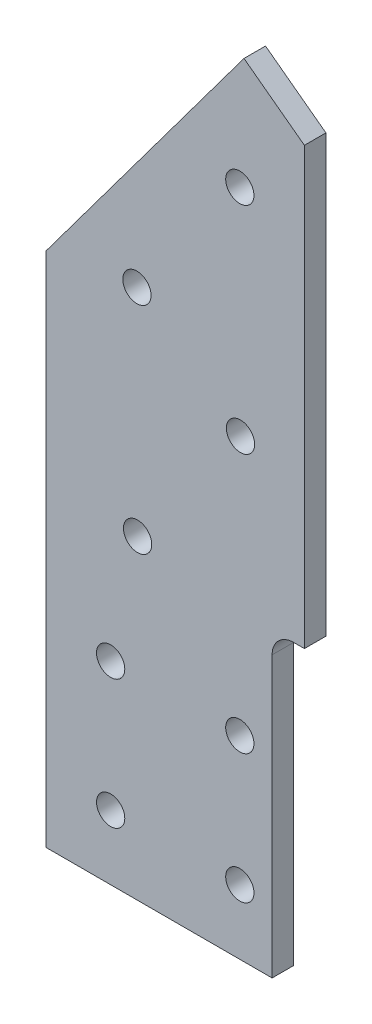
from build123d import *

# Parameters (mm, degrees)
BOSS_EXTRUDE1_DEPTH              = 6.35
F_21_64_0_32813_DIAMETER_HOLE1_D = 8.334502
LPATTERN1_COUNT                  = 2
LPATTERN1_PITCH                  = 38.1
LPATTERN1_COUNT_DIR2             = 2
LPATTERN1_PITCH_DIR2             = 38.1
F_21_64_0_32813_DIAMETER_HOLE2_D = 8.334502
LPATTERN2_COUNT                  = 3
LPATTERN2_PITCH                  = 50.8
LPATTERN2_COUNT_DIR2             = 2
LPATTERN2_PITCH_DIR2             = 38.1
SKETCH7_W                        = 9.525
SKETCH7_H                        = 88.9
CUT_EXTRUDE1_DEPTH               = 244.088107491
FILLET1_R                        = 6.35


with BuildPart() as part:
    # Sketch2 → Boss-Extrude1 (new body)
    with BuildSketch(Plane.XY):
        Polygon((0, 0), (76.2, 0), (76.2, 217.469814476), (58.378218394, 230.748923082), (0, 152.4), align=None)
    extrude(amount=BOSS_EXTRUDE1_DEPTH)

    # 21/64 (0.32813) Diameter Hole1 (through all)
    with Locations(Plane.XY.offset(6.35)):
        with Locations((57.15, 19.05)):
            f_21_64_0_32813_diameter_hole1 = Hole(F_21_64_0_32813_DIAMETER_HOLE1_D / 2)

    # LPattern1: 21_64 _0.32813_ Diameter Hole1 2 × 2
    with Locations(*[(-i * LPATTERN1_PITCH, j * LPATTERN1_PITCH_DIR2, 0) for i in range(LPATTERN1_COUNT) for j in range(LPATTERN1_COUNT_DIR2) if (i, j) != (0, 0)]):
        add(f_21_64_0_32813_diameter_hole1, mode=Mode.SUBTRACT)

    # 21/64 (0.32813) Diameter Hole2 (through all)
    with Locations(Plane.XY.offset(6.35)):
        with Locations((57.15, 197.2169065)):
            f_21_64_0_32813_diameter_hole2 = Hole(F_21_64_0_32813_DIAMETER_HOLE2_D / 2)

    # LPattern2: 21_64 _0.32813_ Diameter Hole2 3 × 2, 2 skipped
    with Locations(*[Vector(-0.597485201625335, -0.8018799372965586, 0) * (i * LPATTERN2_PITCH) + Vector(0.8018799372965592, -0.5974852016253344, 0) * (j * LPATTERN2_PITCH_DIR2) for i in range(LPATTERN2_COUNT) for j in range(LPATTERN2_COUNT_DIR2) if (i, j) not in ((0, 0), (0, 1), (2, 0))]):
        add(f_21_64_0_32813_diameter_hole2, mode=Mode.SUBTRACT)

    # Sketch7 → Cut-Extrude1 (cut, through all)
    with BuildSketch(Plane.XY.offset(6.35)):
        with Locations((71.4375, 44.45)):
            Rectangle(SKETCH7_W, SKETCH7_H)
    extrude(amount=-CUT_EXTRUDE1_DEPTH, mode=Mode.SUBTRACT)

    # Fillet1
    fillet1_edges = [part.edges().sort_by_distance(p)[0] for p in [
        (66.675, 88.9, 3.175),
    ]]
    fillet(fillet1_edges, radius=FILLET1_R)


solid = part.part
